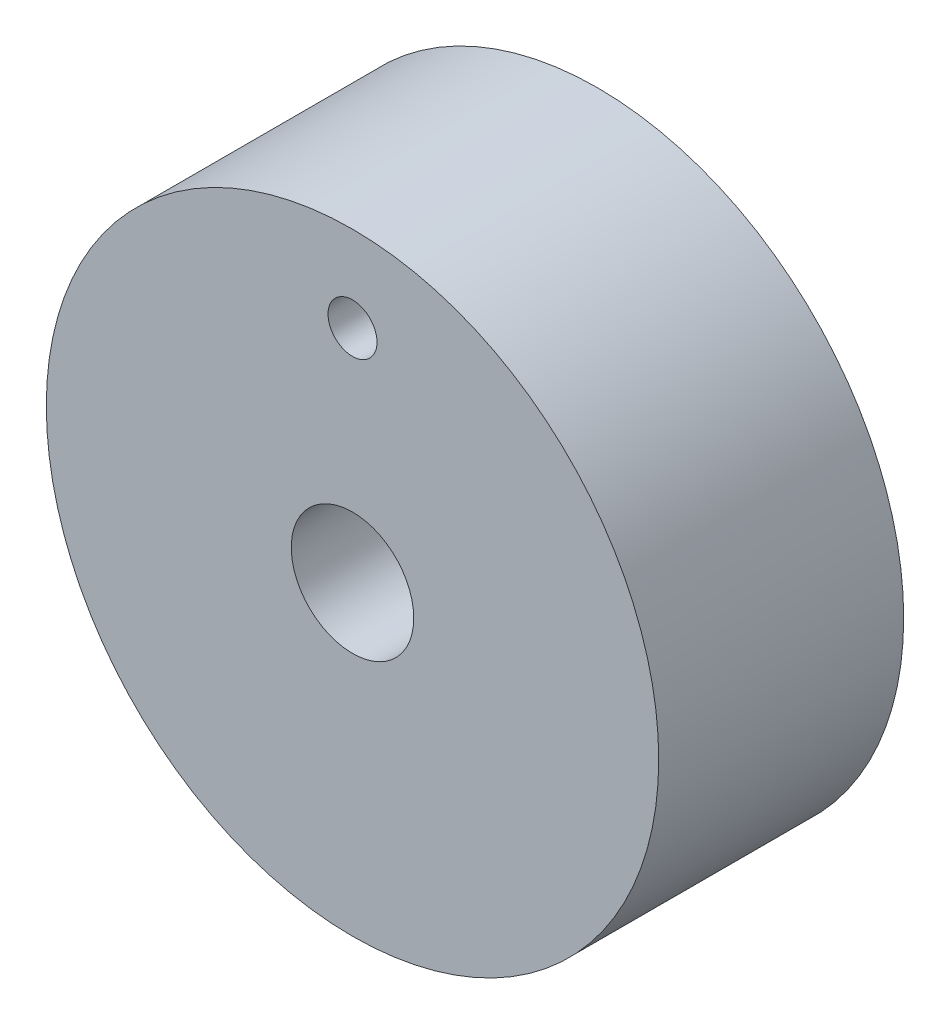
from build123d import *

# Parameters (mm, degrees)
SKETCH1_R           = 25
SKETCH1_R_2         = 5
SKETCH1_R_3         = 2
BOSS_EXTRUDE1_DEPTH = 10


with BuildPart() as part:
    # Sketch1 → Boss-Extrude1 (new, symmetric)
    with BuildSketch(Plane.XY):
        Circle(SKETCH1_R)
        Circle(SKETCH1_R_2, mode=Mode.SUBTRACT)
        with Locations((0, 18)):
            Circle(SKETCH1_R_3, mode=Mode.SUBTRACT)
    extrude(amount=BOSS_EXTRUDE1_DEPTH, both=True)


solid = part.part
